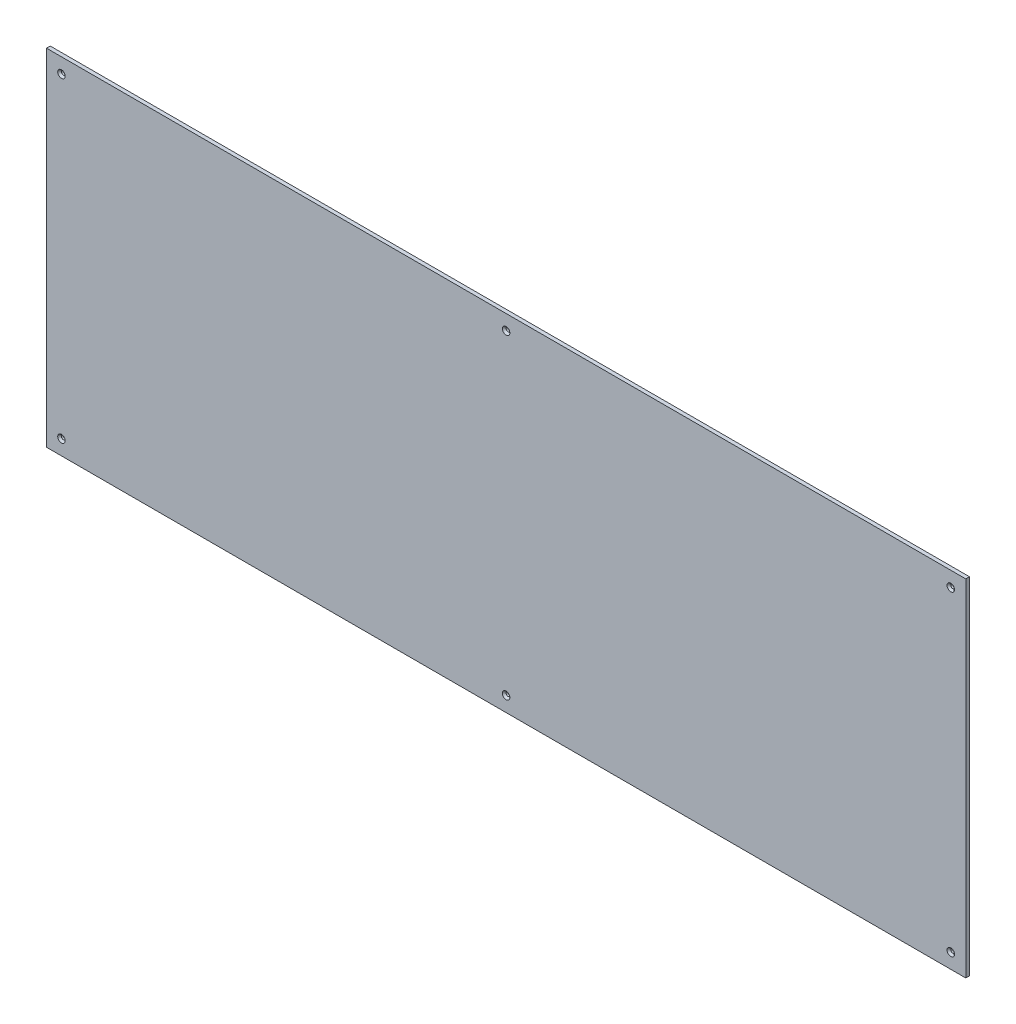
from build123d import *

# Parameters (mm, degrees)
ESQUISSE1_W             = 492
ESQUISSE1_H             = 185
BOSS_EXTRU_1_DEPTH      = 2
ESQUISSE2_R             = 1
ENL_V_MAT_EXTRU_1_DEPTH = 463.44085993
CHANFREIN1_SIZE         = 1


with BuildPart() as part:
    # Esquisse1 → Boss.-Extru.1 (new body)
    with BuildSketch(Plane.XY):
        with Locations((190.790811191, -59.359593679)):
            Rectangle(ESQUISSE1_W, ESQUISSE1_H)
    extrude(amount=BOSS_EXTRU_1_DEPTH)

    # Esquisse2 → Enlèv. mat.-Extru.1 (cut, through all)
    with BuildSketch(Plane(origin=(0, 0, 0), x_dir=(-1, 0, 0), z_dir=(0, 0, -1))):
        with Locations((47.209188809, 25.140406321)):
            Circle(ESQUISSE2_R)
        with Locations((-190.790811191, 25.140406321)):
            Circle(ESQUISSE2_R)
        with Locations((-428.790811191, 25.140406321)):
            Circle(ESQUISSE2_R)
        with Locations((47.209188809, -143.859593679)):
            Circle(ESQUISSE2_R)
        with Locations((-190.790811191, -143.859593679)):
            Circle(ESQUISSE2_R)
        with Locations((-428.790811191, -143.859593679)):
            Circle(ESQUISSE2_R)
    extrude(amount=-ENL_V_MAT_EXTRU_1_DEPTH, mode=Mode.SUBTRACT)

    # Chanfrein1
    chanfrein1_edges = [part.edges().sort_by_distance(p)[0] for p in [
        (-46.209188809, 25.140406321, 2),
        (191.790811191, 25.140406321, 2),
        (429.790811191, 25.140406321, 2),
        (-46.209188809, -143.859593679, 2),
        (191.790811191, -143.859593679, 2),
        (429.790811191, -143.859593679, 2),
    ]]
    chamfer(chanfrein1_edges, length=CHANFREIN1_SIZE)


solid = part.part
